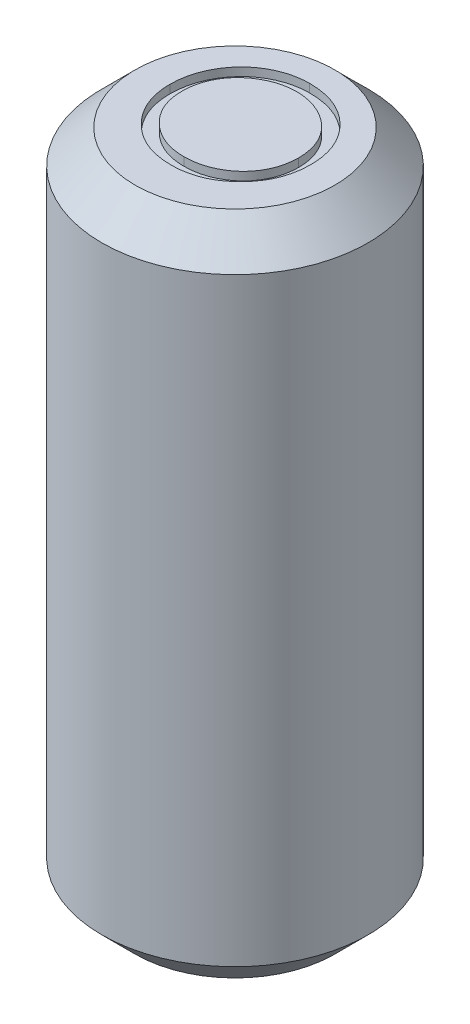
from build123d import *

# Parameters (mm, degrees)
SKETCH1_R           = 4
BOSS_EXTRUDE1_DEPTH = 20
CHAMFER1_SIZE       = 1
CUT_EXTRUDE2_DEPTH  = 0.25


with BuildPart() as part:
    # Sketch1 → Boss-Extrude1 (new body)
    with BuildSketch(Plane(origin=(0, 0, 0), x_dir=(1, 0, 0), z_dir=(0, 1, 0))):
        with Locations(Location((0, 0, 0), (0, 0, 270))):
            Circle(SKETCH1_R)
    extrude(amount=BOSS_EXTRUDE1_DEPTH)

    # Chamfer1
    chamfer1_edges = [part.edges().sort_by_distance(p)[0] for p in [
        (0, 0, -4),
        (0, 20, -4),
    ]]
    chamfer(chamfer1_edges, length=CHAMFER1_SIZE)

    # Sketch3 → Cut-Extrude2 (cut)
    with BuildSketch(Plane(origin=(0, 20, 0), x_dir=(1, 0, 0), z_dir=(0, 1, 0))):
        with BuildLine():
            add(Edge.make_bspline(
                [(-0.024044941, 2.268558778), (0.050021465, 2.266682802), (0.195493999, 2.262998229), (0.409293882, 2.23479354), (0.613402562, 2.185998808), (0.809482721, 2.121012542), (0.99518898, 2.034321816), (1.171919143, 1.92953879), (1.339252713, 1.805565694), (1.494934292, 1.663360863), (1.637399378, 1.508636916), (1.762914677, 1.343519304), (1.868105869, 1.169006387), (1.954489626, 0.985622581), (2.022259466, 0.793782618), (2.069024087, 0.592463757), (2.098896259, 0.382970397), (2.102388576, 0.240082552), (2.104160187, 0.16759724)],
                knots=[0, 0, 0, 0, 1.065120563, 2.091984664, 3.0946048, 4.079830382, 5.057816894, 6.036188127, 7.030412546, 8.04752943, 9.064399622, 10.05169764, 11.02544977, 11.989514704, 12.962713494, 13.945757189, 14.957906945, 16, 16, 16, 16], degree=3))
            add(Edge.make_bspline(
                [(2.104160187, 0.16759724), (2.102388835, 0.095645872), (2.098897296, -0.046178608), (2.068990122, -0.254342544), (2.022086122, -0.454446197), (1.955118961, -0.646155515), (1.869146985, -0.829672731), (1.763255361, -1.004514964), (1.638522549, -1.170739533), (1.496571862, -1.326525436), (1.341827814, -1.469379688), (1.175850366, -1.593858404), (1.002372286, -1.700971689), (0.819161191, -1.786438745), (0.628646864, -1.854749511), (0.429124209, -1.901323945), (0.221528147, -1.93136628), (0.079961285, -1.934816013), (0.008006341, -1.936569427)],
                knots=[0, 0, 0, 0, 1.043624062, 2.057103931, 3.04512605, 4.022047818, 4.998200453, 5.980619268, 6.982898556, 8.009068085, 9.034988726, 10.034168286, 11.015286542, 11.987931943, 12.962482838, 13.94673481, 14.956375938, 16, 16, 16, 16], degree=3))
            add(Edge.make_bspline(
                [(0.008006341, -1.936569427), (-0.064478595, -1.934798699), (-0.207365699, -1.931308123), (-0.417122311, -1.901386518), (-0.61858259, -1.854596456), (-0.81117042, -1.787728529), (-0.994993196, -1.701308837), (-1.170410434, -1.595932404), (-1.336718031, -1.470895671), (-1.492537169, -1.328991014), (-1.635107682, -1.17450924), (-1.759404111, -1.008984377), (-1.864804241, -0.835663856), (-1.950933763, -0.654066685), (-2.019121717, -0.465070751), (-2.065641509, -0.267415348), (-2.09573974, -0.062227341), (-2.099208136, 0.077478828), (-2.100968018, 0.148366471)],
                knots=[0, 0, 0, 0, 1.053102029, 2.075944431, 3.073151272, 4.055350789, 5.033113405, 6.020478099, 7.024410459, 8.052272461, 9.079885166, 10.07527673, 11.055994387, 12.023226415, 12.992069828, 13.970394897, 14.97016774, 16, 16, 16, 16], degree=3))
            add(Edge.make_bspline(
                [(-2.100968018, 0.148366471), (-2.100357006, 0.195946664), (-2.09914269, 0.290506805), (-2.084523613, 0.430925777), (-2.063310241, 0.569086528), (-2.032908055, 0.704596183), (-1.99314615, 0.837123023), (-1.946229547, 0.967581037), (-1.888926867, 1.09464815), (-1.824148983, 1.218926312), (-1.751849774, 1.338478205), (-1.671991774, 1.451483443), (-1.587379925, 1.558890296), (-1.494621761, 1.657915443), (-1.396774395, 1.751439622), (-1.292250534, 1.838025584), (-1.181687969, 1.9184541), (-1.064610964, 1.990934489), (-0.943904364, 2.056487786), (-0.819473761, 2.11274133), (-0.693009107, 2.161022543), (-0.563918081, 2.200154915), (-0.432543485, 2.23104867), (-0.298598588, 2.252085646), (-0.162190101, 2.266742009), (-0.07029145, 2.267950583), (-0.024044941, 2.268558778)],
                knots=[0, 0, 0, 0, 1.037015668, 2.060948919, 3.074880161, 4.083647147, 5.086022904, 6.090072063, 7.104153813, 8.122640571, 9.144368836, 10.147691507, 11.138137339, 12.123020368, 13.103399296, 14.087645067, 15.080126199, 16.082011238, 17.087798457, 18.072939717, 19.057185487, 20.037253025, 21.01195951, 21.997135196, 22.992090687, 24, 24, 24, 24], degree=3))
        make_face()
        with BuildLine():
            add(Edge.make_bspline(
                [(-0.006416736, 1.858302368), (-0.044376317, 1.857839636), (-0.119932584, 1.856918597), (-0.232257768, 1.84478635), (-0.343105692, 1.827495049), (-0.452499249, 1.802830453), (-0.559980723, 1.769225822), (-0.66655197, 1.730550498), (-0.771241174, 1.68344068), (-0.873702726, 1.630214732), (-0.97303424, 1.57130168), (-1.066763042, 1.506191089), (-1.155131778, 1.436409884), (-1.237924083, 1.361795213), (-1.314896851, 1.281967097), (-1.387565081, 1.198135741), (-1.453016032, 1.107905008), (-1.512999548, 1.013721686), (-1.56667708, 0.915708451), (-1.614408914, 0.814897179), (-1.653453495, 0.710465537), (-1.685296211, 0.6035465), (-1.711695995, 0.494309403), (-1.728420479, 0.381925576), (-1.740686033, 0.266959734), (-1.741554428, 0.189266186), (-1.741993659, 0.149969035)],
                knots=[0, 0, 0, 0, 1.008559885, 2.007477868, 2.99961109, 3.989939068, 4.984837346, 5.991145699, 7.001802488, 8.033829008, 9.059044045, 10.069351652, 11.065060232, 12.050310815, 13.029377138, 14.011219647, 14.996725999, 15.989392538, 16.977580475, 17.965360261, 18.951710183, 19.937753436, 20.929683414, 21.935841486, 22.955955122, 24, 24, 24, 24], degree=3))
            add(Edge.make_bspline(
                [(-1.741993659, 0.149969035), (-1.740536674, 0.092183639), (-1.737670334, -0.021498109), (-1.712575968, -0.188090274), (-1.673922283, -0.348191173), (-1.616942436, -0.500924783), (-1.54568459, -0.647603964), (-1.457653858, -0.786927512), (-1.353357761, -0.918933082), (-1.234885159, -1.042699104), (-1.105373494, -1.155665738), (-0.967850374, -1.254823919), (-0.823789109, -1.338721347), (-0.67281402, -1.407070001), (-0.515731118, -1.461229702), (-0.351528202, -1.498348137), (-0.181299106, -1.522777229), (-0.065264071, -1.525123236), (-0.006416736, -1.526313017)],
                knots=[0, 0, 0, 0, 1.032063989, 2.030389145, 3.003944642, 3.970395727, 4.937377036, 5.913328081, 6.909231446, 7.93887556, 8.970685674, 9.976071282, 10.964166581, 11.944589148, 12.933237628, 13.927779006, 14.949070134, 16, 16, 16, 16], degree=3))
            add(Edge.make_bspline(
                [(-0.006416736, -1.526313017), (0.03313698, -1.525769583), (0.111583879, -1.524691791), (0.228264476, -1.51383616), (0.342843003, -1.49642831), (0.455158752, -1.471364703), (0.56508425, -1.439996467), (0.673078311, -1.402730493), (0.777990643, -1.356237688), (0.881144743, -1.304868601), (0.979883305, -1.246308421), (1.074141056, -1.183407678), (1.161542176, -1.113729255), (1.244272544, -1.040223183), (1.321561331, -0.961407357), (1.392885884, -0.877384246), (1.458006035, -0.787623495), (1.517966774, -0.693583032), (1.571456218, -0.5953016), (1.618060902, -0.494124825), (1.65759932, -0.390301843), (1.689517612, -0.283682904), (1.714529568, -0.174470506), (1.731763762, -0.062518416), (1.74381912, 0.051949404), (1.74472778, 0.129370953), (1.745185828, 0.168398522)],
                knots=[0, 0, 0, 0, 1.047197238, 2.076906641, 3.100256066, 4.114471768, 5.12198147, 6.126382909, 7.136867548, 8.15857795, 9.17633901, 10.174870724, 11.156907918, 12.133735059, 13.104061851, 14.077631395, 15.04955518, 16.038496417, 17.029181396, 18.010275684, 18.986308667, 19.968651475, 20.955262928, 21.950658345, 22.966943676, 24, 24, 24, 24], degree=3))
            add(Edge.make_bspline(
                [(1.745185828, 0.168398522), (1.744727413, 0.207159098), (1.743818063, 0.284047841), (1.73176952, 0.397717348), (1.71451136, 0.508863875), (1.689639694, 0.617051079), (1.657582375, 0.722306536), (1.618053997, 0.82453139), (1.571442227, 0.924106471), (1.517947113, 1.020785667), (1.457814743, 1.113556796), (1.392107037, 1.202245268), (1.319689496, 1.285185543), (1.242631182, 1.364425194), (1.159007313, 1.43827421), (1.069196691, 1.506757091), (0.974289631, 1.571526548), (0.873801362, 1.629955761), (0.770093986, 1.683914884), (0.663678034, 1.730144602), (0.555759063, 1.769427024), (0.446611506, 1.802932127), (0.335316674, 1.827398447), (0.222626584, 1.844801933), (0.108697145, 1.856914374), (0.032076323, 1.857838235), (-0.006416736, 1.858302368)],
                knots=[0, 0, 0, 0, 1.02996197, 2.043119294, 3.035359645, 4.018872909, 4.991431989, 5.957985074, 6.929999688, 7.912076566, 8.892894881, 9.867085534, 10.843653904, 11.817741046, 12.803660682, 13.806313499, 14.818574707, 15.856120519, 16.894564902, 17.924820532, 18.937903209, 19.946497019, 20.957711757, 21.963978472, 22.977135795, 24, 24, 24, 24], degree=3))
        make_face(mode=Mode.SUBTRACT)
    extrude(amount=-CUT_EXTRUDE2_DEPTH, mode=Mode.SUBTRACT)


solid = part.part
